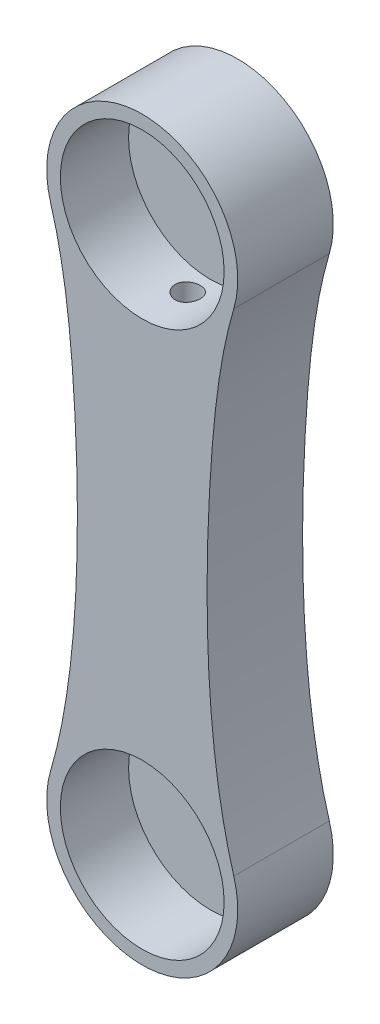
from build123d import *

# Parameters (mm, degrees)
SKETCH1_R             = 21
BOSS_EXTRUDE2_DEPTH   = 5
BOSS_EXTRUDE2_2_DEPTH = 5
BOSS_EXTRUDE5_DEPTH   = 16
SKETCH8_R             = 18
CUT_EXTRUDE3_DEPTH    = 144.342247908
BOSS_EXTRUDE6_START   = 5
BOSS_EXTRUDE6_DEPTH   = 5
SKETCH10_R            = 2.75
CUT_EXTRUDE4_DEPTH    = 114


with BuildPart() as part:
    # Sketch1 → Boss-Extrude2 (new body)
    with BuildSketch(Plane.XY):
        with Locations((0, 120)):
            Circle(SKETCH1_R)
    extrude(amount=BOSS_EXTRUDE2_DEPTH)



with BuildPart() as body_2:
    # Sketch1 → Boss-Extrude2 2 (new body)
    with BuildSketch(Plane.XY):
        Circle(SKETCH1_R)
    extrude(amount=BOSS_EXTRUDE2_2_DEPTH)


with BuildPart() as part_1:
    add(part.part)

    add(body_2.part)  # Boss-Extrude5 merges body 2
    # Sketch5 → Boss-Extrude5 (add)
    with BuildSketch(Plane.XY.offset(5)):
        with BuildLine():
            add(Edge.make_bspline(
                [(-20.124611797, 114), (-17.072662318, 103.763450251), (-12.954200117, 66.897613413), (-14.18067636, 25.936565539), (-20.124611797, 6)],
                knots=[0, 0, 0, 0, 0.316724685, 1, 1, 1, 1], degree=3))
            ThreePointArc((-20.124611797, 6), (0, -21), (20.124611797, 6))
            add(Edge.make_bspline(
                [(20.124611797, 114), (17.072662318, 103.763450251), (12.954200117, 66.897613413), (14.18067636, 25.936565539), (20.124611797, 6)],
                knots=[0, 0, 0, 0, 0.316724685, 1, 1, 1, 1], degree=3))
            ThreePointArc((20.124611797, 114), (0, 141), (-20.124611797, 114))
        make_face()
    extrude(amount=BOSS_EXTRUDE5_DEPTH)

    # Sketch8 → Cut-Extrude3 (cut, through all)
    with BuildSketch(Plane(origin=(0, 0, 6), x_dir=(-1, 0, 0), z_dir=(0, 0, -1))):
        with Locations((0, 120)):
            Circle(SKETCH8_R)
        Circle(SKETCH8_R)
    extrude(amount=-CUT_EXTRUDE3_DEPTH, mode=Mode.SUBTRACT)

    # Sketch9 → Boss-Extrude6 (add)
    with BuildSketch(Plane(origin=(0, 0, 5), x_dir=(-1, 0, 0), z_dir=(0, 0, -1)).offset(BOSS_EXTRUDE6_START)):
        with BuildLine():
            ThreePointArc((-20.124611797, 114), (0, 99), (20.124611797, 114))
            add(Edge.make_bspline(
                [(20.124611797, 6), (14.18067636, 25.936565539), (12.954200117, 66.897613413), (17.072662318, 103.763450251), (20.124611797, 114)],
                knots=[0, 0, 0, 0, 0.683275315, 1, 1, 1, 1], degree=3))
            ThreePointArc((20.124611797, 6), (0, 21), (-20.124611797, 6))
            add(Edge.make_bspline(
                [(-20.124611797, 114), (-17.072662318, 103.763450251), (-12.954200117, 66.897613413), (-14.18067636, 25.936565539), (-20.124611797, 6)],
                knots=[0, 0, 0, 0, 0.316724685, 1, 1, 1, 1], degree=3))
        make_face()
    extrude(amount=-BOSS_EXTRUDE6_DEPTH)

    # Sketch10 → Cut-Extrude4 (cut)
    with BuildSketch(Plane(origin=(0, 0, 0), x_dir=(1, 0, 0), z_dir=(0, 1, 0))):
        with Locations(Location((0, -11, 0), (0, 0, 90))):
            Circle(SKETCH10_R)
    extrude(amount=CUT_EXTRUDE4_DEPTH, mode=Mode.SUBTRACT)


solid = part_1.part
